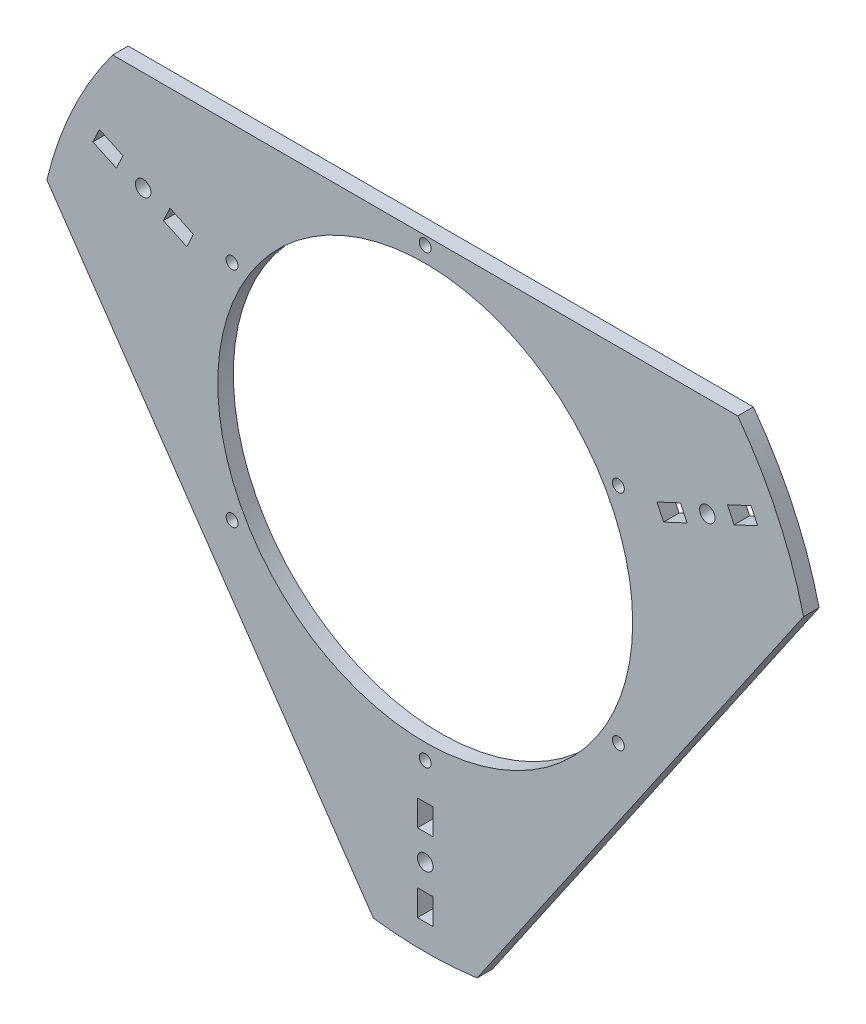
from build123d import *

# Parameters (mm, degrees)
SKETCH1_R           = 40
SKETCH1_R_2         = 1.15
SKETCH1_R_3         = 1.5
SKETCH1_W           = 3
SKETCH1_H           = 5
BOSS_EXTRUDE1_DEPTH = 3


with BuildPart() as part:
    # Sketch1 → Boss-Extrude1 (new body)
    with BuildSketch(Plane.XY):
        with BuildLine():
            Line((-72.939022771, 17.461356112), (-10, -74.330343737))
            ThreePointArc((-10, -74.330343737), (0, -75), (10, -74.330343737))
            Line((10, -74.330343737), (72.939022771, 17.461356112))
            ThreePointArc((72.939022771, 17.461356112), (67.973084028, 31.696369631), (60.260474918, 44.650589723))
            Line((60.260474918, 44.650589723), (-60.260474918, 44.650589723))
            ThreePointArc((-60.260474918, 44.650589723), (-67.973084028, 31.696369631), (-72.939022771, 17.461356112))
        make_face()
        Circle(SKETCH1_R, mode=Mode.SUBTRACT)
        with Locations((0, -43)):
            Circle(SKETCH1_R_2, mode=Mode.SUBTRACT)
        with Locations((-37.239092363, -21.5)):
            Circle(SKETCH1_R_2, mode=Mode.SUBTRACT)
        with Locations((-37.239092363, 21.5)):
            Circle(SKETCH1_R_2, mode=Mode.SUBTRACT)
        with Locations((0, 43)):
            Circle(SKETCH1_R_2, mode=Mode.SUBTRACT)
        with Locations((37.239092363, 21.5)):
            Circle(SKETCH1_R_2, mode=Mode.SUBTRACT)
        with Locations((37.239092363, -21.5)):
            Circle(SKETCH1_R_2, mode=Mode.SUBTRACT)
        with Locations((0, -60)):
            Circle(SKETCH1_R_3, mode=Mode.SUBTRACT)
        with Locations((54.378467222, 25.357095704)):
            Circle(SKETCH1_R_3, mode=Mode.SUBTRACT)
        with Locations((-54.378467222, 25.357095704)):
            Circle(SKETCH1_R_3, mode=Mode.SUBTRACT)
        with Locations((0, -52.5)):
            Rectangle(SKETCH1_W, SKETCH1_H, mode=Mode.SUBTRACT)
        with Locations((0, -67.5)):
            Rectangle(SKETCH1_W, SKETCH1_H, mode=Mode.SUBTRACT)
        Polygon((49.213000894, 24.603466076), (44.681461959, 22.490374768), (45.949316744, 19.771451406), (50.48085568, 21.884542715), align=None, mode=Mode.SUBTRACT)
        Polygon((58.276078765, 28.829648694), (62.8076177, 30.942740002), (64.075472485, 28.223816641), (59.54393355, 26.110725333), align=None, mode=Mode.SUBTRACT)
        Polygon((-58.276078765, 28.829648694), (-62.8076177, 30.942740002), (-64.075472485, 28.223816641), (-59.54393355, 26.110725333), align=None, mode=Mode.SUBTRACT)
        Polygon((-49.213000894, 24.603466076), (-44.681461959, 22.490374768), (-45.949316744, 19.771451406), (-50.48085568, 21.884542715), align=None, mode=Mode.SUBTRACT)
    extrude(amount=BOSS_EXTRUDE1_DEPTH)


solid = part.part
